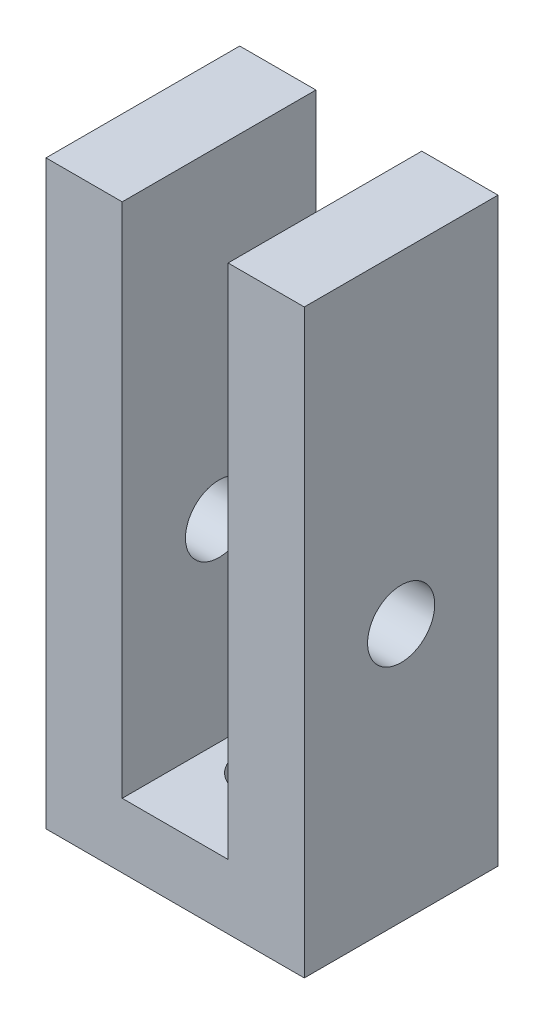
from build123d import *

# Parameters (mm, degrees)
SKETCH_5_W          = 20
SKETCH_5_H          = 15
EXTRUDE_5_DEPTH     = 5
CUT_EXTRUDE_6_REACH = 27.495
SKETCH_6_R          = 2.6
SKETCH_7_W          = 5.9
SKETCH_7_H          = 15
EXTRUDE_7_DEPTH     = 40
SKETCH_8_R          = 2.6
CUT_EXTRUDE_8_DEPTH = 52.478150705


with BuildPart() as part:
    # Эскиз5 → Вытянуть5 (new body)
    with BuildSketch(Plane(origin=(0, 0, 0), x_dir=(1, 0, 0), z_dir=(0, 1, 0))):
        with Locations((10, 7.5)):
            Rectangle(SKETCH_5_W, SKETCH_5_H)
    extrude(amount=EXTRUDE_5_DEPTH)

    # Эскиз6 → Вытянуть6 (cut, up to next)
    with BuildSketch(Plane(origin=(0, 5, 0), x_dir=(1, 0, 0), z_dir=(0, 1, 0)), mode=Mode.PRIVATE) as cut_extrude_6_sk1:
        with Locations(Location((10, 7.5, 0), (0, 0, 270))):
            Circle(SKETCH_6_R)
    cut_extrude_6_tool1 = extrude(cut_extrude_6_sk1.sketch, amount=-CUT_EXTRUDE_6_REACH, mode=Mode.PRIVATE) & part.part
    add(cut_extrude_6_tool1.solids().sort_by_distance((10, 5, -7.5))[0], mode=Mode.SUBTRACT)

    # Эскиз7 → Вытянуть7 (add)
    with BuildSketch(Plane(origin=(0, 5, 0), x_dir=(1, 0, 0), z_dir=(0, 1, 0))):
        with Locations((2.95, 7.5)):
            Rectangle(SKETCH_7_W, SKETCH_7_H)
        with Locations((17.05, 7.5)):
            Rectangle(SKETCH_7_W, SKETCH_7_H)
    extrude(amount=EXTRUDE_7_DEPTH)

    # Эскиз8 → Вытянуть8 (cut, through all)
    with BuildSketch(Plane.ZY):
        with Locations((-7.5, 20)):
            Circle(SKETCH_8_R)
    extrude(amount=-CUT_EXTRUDE_8_DEPTH, mode=Mode.SUBTRACT)


solid = part.part
